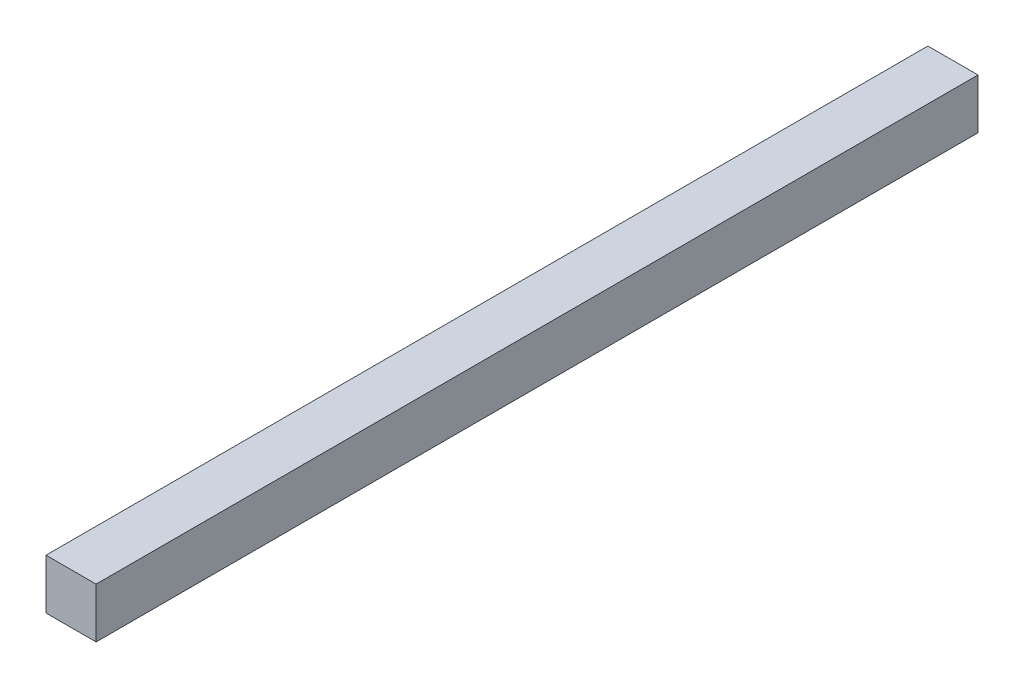
from build123d import *

# Parameters (mm, degrees)
ESBO_O1_W                = 0.5
ESBO_O1_H                = 0.5
RESSALTO_EXTRUS_O1_DEPTH = 8.8


with BuildPart() as part:
    # Esboço1 → Ressalto-extrusão1 (new body)
    with BuildSketch(Plane.XY):
        with Locations((-0.25, 0.25)):
            Rectangle(ESBO_O1_W, ESBO_O1_H)
    extrude(amount=RESSALTO_EXTRUS_O1_DEPTH)


solid = part.part
